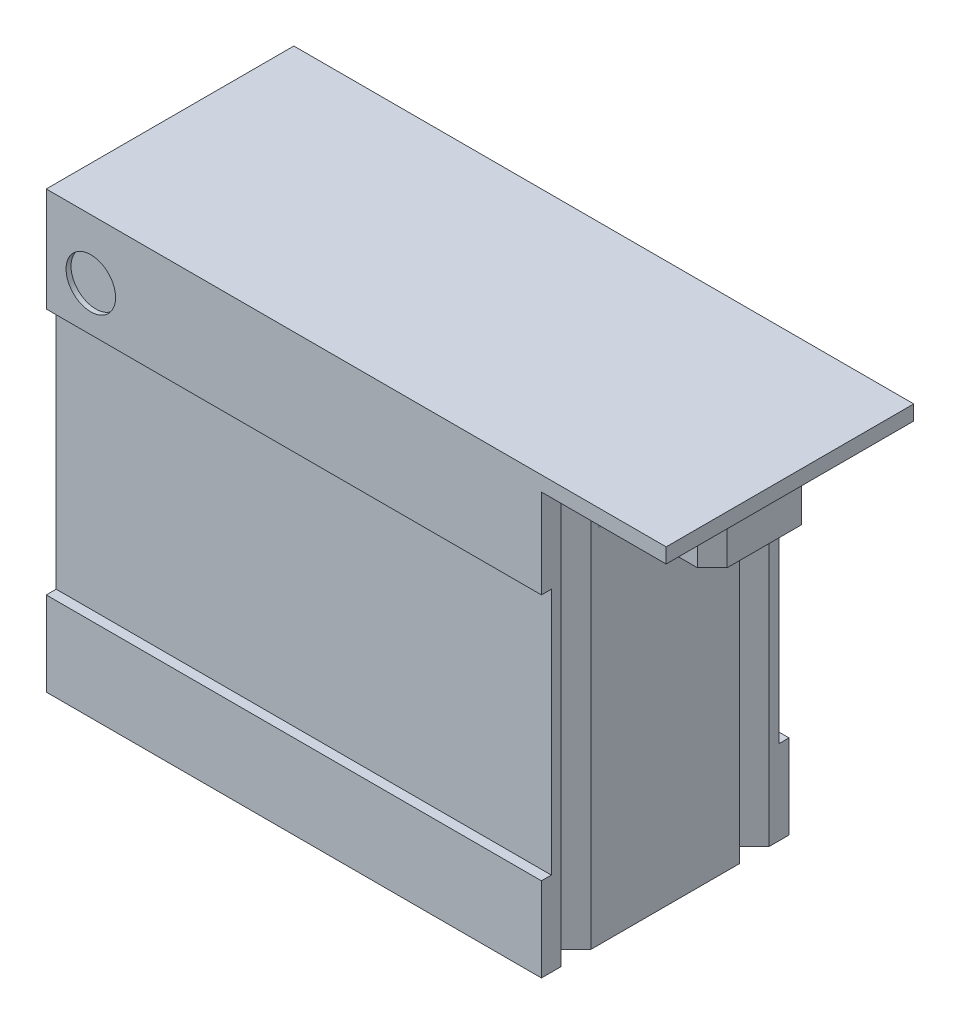
from build123d import *

# Parameters (mm, degrees)
SKETCH11_W          = 10
SKETCH11_H          = 5
BOSS_EXTRUDE2_DEPTH = 8.5
SKETCH12_OUTSIDE_W  = 9.808
SKETCH12_OUTSIDE_H  = 13.308
CUT_EXTRUDE1_DEPTH  = 11
CUT_EXTRUDE2_DEPTH  = 8.3
CUT_EXTRUDE6_DEPTH  = 6
CUT_EXTRUDE3_DEPTH  = 1.5
CUT_EXTRUDE4_DEPTH  = 8.3
BOSS_EXTRUDE3_DEPTH = 9.5
CUT_EXTRUDE5_DEPTH  = 9.5
SKETCH19_R          = 0.5
CUT_EXTRUDE7_DEPTH  = 0.1
CUT_EXTRUDE8_START  = -0.1
SKETCH20_R          = 0.5
CUT_EXTRUDE8_DEPTH  = 0.1
SKETCH21_R          = 0.425
BOSS_EXTRUDE4_DEPTH = 1.2
SKETCH22_W          = 9.218939703
SKETCH22_H          = 4.445853418
BOSS_EXTRUDE5_DEPTH = 8.2
SKETCH23_W          = 12.5189076
SKETCH23_H          = 5
BOSS_EXTRUDE6_DEPTH = 0.3


with BuildPart() as part:
    # Sketch11 → Boss-Extrude2 (new body)
    with BuildSketch(Plane(origin=(0, 0, 0), x_dir=(1, 0, 0), z_dir=(0, 1, 0))):
        with Locations((5, 2.5)):
            Rectangle(SKETCH11_W, SKETCH11_H)
    extrude(amount=BOSS_EXTRUDE2_DEPTH)

    # Sketch12 outside → Cut-Extrude1 (cut)
    with BuildSketch(Plane(origin=(10, 0, 0), x_dir=(0, 0, -1), z_dir=(1, 0, 0))):
        with Locations((2.5, 4.25)):
            Rectangle(SKETCH12_OUTSIDE_W, SKETCH12_OUTSIDE_H)
        Polygon((0, 8.5), (0, 6.7), (0.2, 6.7), (0.2, 1.7), (0, 1.7), (0, 0), (5, 0), (5, 1.7), (4.8, 1.7), (4.8, 6.7), (5, 6.7), (5, 8.5), align=None, mode=Mode.SUBTRACT)
    extrude(amount=-CUT_EXTRUDE1_DEPTH, mode=Mode.SUBTRACT)

    # Sketch13 → Cut-Extrude2 (cut)
    with BuildSketch(Plane.XZ.offset(-8.5)):
        with BuildLine():
            Line((1, -0.6), (9, -0.6))
            ThreePointArc((9, -0.6), (9.141421356, -0.658578644), (9.2, -0.8))
            Line((9.2, -0.8), (9.2, -4.2))
            ThreePointArc((9.2, -4.2), (9.141421356, -4.341421356), (9, -4.4))
            Line((9, -4.4), (1, -4.4))
            ThreePointArc((1, -4.4), (0.858578644, -4.341421356), (0.8, -4.2))
            Line((0.8, -4.2), (0.8, -0.8))
            ThreePointArc((0.8, -0.8), (0.858578644, -0.658578644), (1, -0.6))
        make_face()
    extrude(amount=CUT_EXTRUDE2_DEPTH, mode=Mode.SUBTRACT)

    # Sketch18 → Cut-Extrude6 (cut)
    with BuildSketch(Plane(origin=(0, 8.5, 0), x_dir=(1, 0, 0), z_dir=(0, 1, 0))):
        with BuildLine():
            Line((1.5, 3.855615714), (4.2, 3.855615714))
            Line((4.2, 3.855615714), (4.2, 4.4))
            ThreePointArc((4.2, 4.4), (4.141421356, 4.541421356), (4, 4.6))
            Line((4, 4.6), (1.7, 4.6))
            ThreePointArc((1.7, 4.6), (1.558578644, 4.541421356), (1.5, 4.4))
            Line((1.5, 4.4), (1.5, 3.855615714))
        make_face()
    extrude(amount=-CUT_EXTRUDE6_DEPTH, mode=Mode.SUBTRACT)

    # Sketch14 → Cut-Extrude3 (cut)
    with BuildSketch(Plane.XZ.offset(-8.5)):
        with BuildLine():
            Line((8.5, -4.6), (1.5, -4.6))
            ThreePointArc((1.5, -4.6), (0.792893219, -4.307106781), (0.5, -3.6))
            Line((0.5, -3.6), (0.5, -1.4))
            ThreePointArc((0.5, -1.4), (0.792893219, -0.692893219), (1.5, -0.4))
            Line((1.5, -0.4), (8.5, -0.4))
            ThreePointArc((8.5, -0.4), (9.207106781, -0.692893219), (9.5, -1.4))
            Line((9.5, -1.4), (9.5, -3.6))
            ThreePointArc((9.5, -3.6), (9.207106781, -4.307106781), (8.5, -4.6))
        make_face()
    extrude(amount=CUT_EXTRUDE3_DEPTH, mode=Mode.SUBTRACT)

    # Sketch15 → Cut-Extrude4 (cut)
    with BuildSketch(Plane(origin=(0, 8.5, 0), x_dir=(1, 0, 0), z_dir=(0, 1, 0))):
        with BuildLine():
            Line((0.6, 3.6), (9.4, 3.6))
            ThreePointArc((9.4, 3.6), (9.470710678, 3.570710678), (9.5, 3.5))
            Line((9.5, 3.5), (9.5, 1.5))
            ThreePointArc((9.5, 1.5), (9.470710678, 1.429289322), (9.4, 1.4))
            Line((9.4, 1.4), (0.6, 1.4))
            ThreePointArc((0.6, 1.4), (0.529289322, 1.429289322), (0.5, 1.5))
            Line((0.5, 1.5), (0.5, 3.5))
            ThreePointArc((0.5, 3.5), (0.529289322, 3.570710678), (0.6, 3.6))
        make_face()
    extrude(amount=-CUT_EXTRUDE4_DEPTH, mode=Mode.SUBTRACT)

    # Sketch16 → Boss-Extrude3 (add)
    with BuildSketch(Plane.ZY):
        Polygon((-4.839479829, 0.939479829), (-4.1, 0.2), (-4.839479829, 0.2), align=None)
        Polygon((-0.9, 0.2), (-0.040645339, 1.059354661), (-0.040645339, 0.2), align=None)
    extrude(amount=-BOSS_EXTRUDE3_DEPTH)

    # Sketch17 → Cut-Extrude5 (cut)
    with BuildSketch(Plane(origin=(0, 8.5, 0), x_dir=(1, 0, 0), z_dir=(0, 1, 0))):
        Polygon((-0.242330702, 4.842330702), (0.3, 4.3), (-0.242330702, 3.757669298), align=None)
        Polygon((10.242330702, 3.757669298), (10.242330702, 4.842330702), (9.7, 4.3), align=None)
        Polygon((10.242330702, 0.157669298), (9.7, 0.7), (10.242330702, 1.242330702), align=None)
        Polygon((-0.242330702, 1.242330702), (-0.242330702, 0.157669298), (0.3, 0.7), align=None)
    extrude(amount=-CUT_EXTRUDE5_DEPTH, mode=Mode.SUBTRACT)

    # Sketch19 → Cut-Extrude7 (cut)
    with BuildSketch(Plane.XY):
        with Locations((0.9, 7.6)):
            Circle(SKETCH19_R)
    extrude(amount=-CUT_EXTRUDE7_DEPTH, mode=Mode.SUBTRACT)

    # Sketch20 → Cut-Extrude8 (cut)
    with BuildSketch(Plane(origin=(0, 0, -5), x_dir=(-1, 0, 0), z_dir=(0, 0, -1)).offset(CUT_EXTRUDE8_START)):
        with Locations(Location((-0.9, 7.6, 0), (0, 0, 180))):
            Circle(SKETCH20_R)
    extrude(amount=CUT_EXTRUDE8_DEPTH, mode=Mode.SUBTRACT)

    # Sketch21 → Boss-Extrude4 (add)
    with BuildSketch(Plane(origin=(0, 8.5, 0), x_dir=(1, 0, 0), z_dir=(0, 1, 0))):
        with BuildLine():
            Line((10.3, 3.55), (11.7, 3.55))
            Line((11.7, 3.55), (12, 3.25))
            Line((12, 3.25), (12, 1.75))
            Line((12, 1.75), (11.7, 1.45))
            Line((11.7, 1.45), (10.3, 1.45))
            ThreePointArc((10.3, 1.45), (10.087867966, 1.362132034), (10, 1.15))
            Line((10, 1.15), (10, 1))
            Line((10, 1), (9.555439603, 1))
            Line((9.555439603, 1), (9.555439603, 3.976356754))
            Line((9.555439603, 3.976356754), (10, 3.976356754))
            Line((10, 3.976356754), (10, 3.85))
            ThreePointArc((10, 3.85), (10.087867966, 3.637867966), (10.3, 3.55))
        make_face()
        with Locations(Location((11, 2.5, 0), (0, 0, 270))):
            Circle(SKETCH21_R, mode=Mode.SUBTRACT)
    extrude(amount=-BOSS_EXTRUDE4_DEPTH)

    # Sketch22 → Boss-Extrude5 (add)
    with BuildSketch(Plane(origin=(0, 0.2, 0), x_dir=(1, 0, 0), z_dir=(0, 1, 0))):
        with Locations((4.995733619, 2.483074162)):
            Rectangle(SKETCH22_W, SKETCH22_H)
    extrude(amount=BOSS_EXTRUDE5_DEPTH)

    # Sketch23 → Boss-Extrude6 (add)
    with BuildSketch(Plane(origin=(0, 8.5, 0), x_dir=(1, 0, 0), z_dir=(0, 1, 0))):
        with Locations((6.2594538, 2.5)):
            Rectangle(SKETCH23_W, SKETCH23_H)
    extrude(amount=BOSS_EXTRUDE6_DEPTH)


solid = part.part
